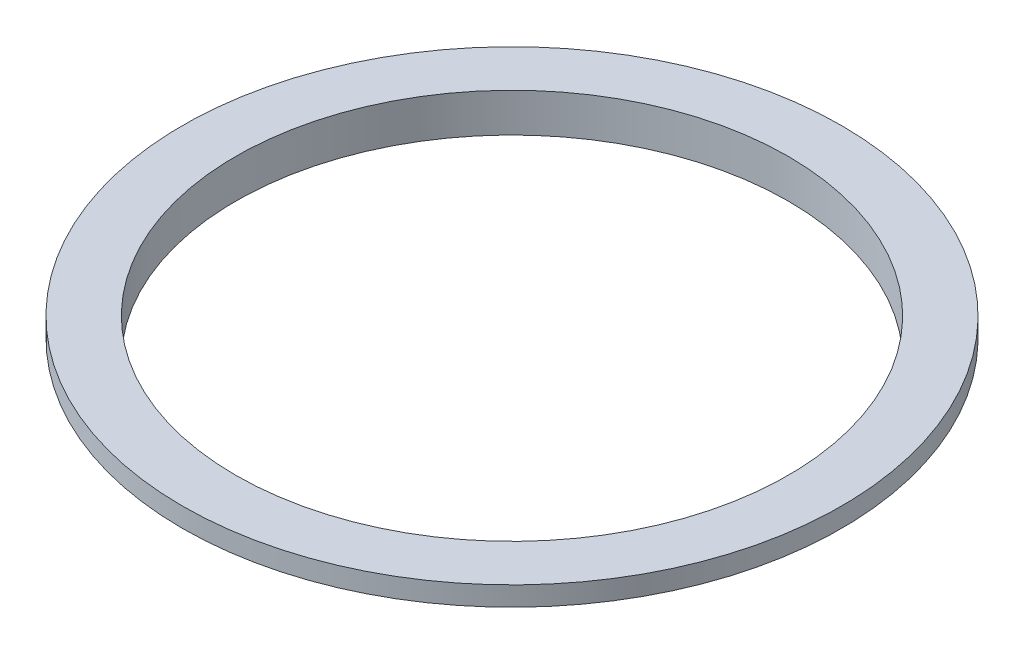
from build123d import *

# Parameters (mm, degrees)
SKETCH_1_R      = 31
SKETCH_1_R_2    = 28.5
EXTRUDE_1_DEPTH = 2
SKETCH_2_R      = 34
SKETCH_2_R_2    = 28.5
EXTRUDE_2_DEPTH = 2


with BuildPart() as part:
    # 草图1 → 凸台-拉伸1 (new body)
    with BuildSketch(Plane(origin=(0, 0, 0), x_dir=(1, 0, 0), z_dir=(0, 1, 0))):
        with Locations(Location((0, 0, 0), (0, 0, 270))):
            Circle(SKETCH_1_R)
        with Locations(Location((0, 0, 0), (0, 0, 270))):
            Circle(SKETCH_1_R_2, mode=Mode.SUBTRACT)
    extrude(amount=EXTRUDE_1_DEPTH)

    # 草图2 → 凸台-拉伸2 (add)
    with BuildSketch(Plane(origin=(0, 2, 0), x_dir=(1, 0, 0), z_dir=(0, 1, 0))):
        with Locations(Location((0, 0, 0), (0, 0, 270))):
            Circle(SKETCH_2_R)
        with Locations(Location((0, 0, 0), (0, 0, 270))):
            Circle(SKETCH_2_R_2, mode=Mode.SUBTRACT)
    extrude(amount=EXTRUDE_2_DEPTH)


solid = part.part
